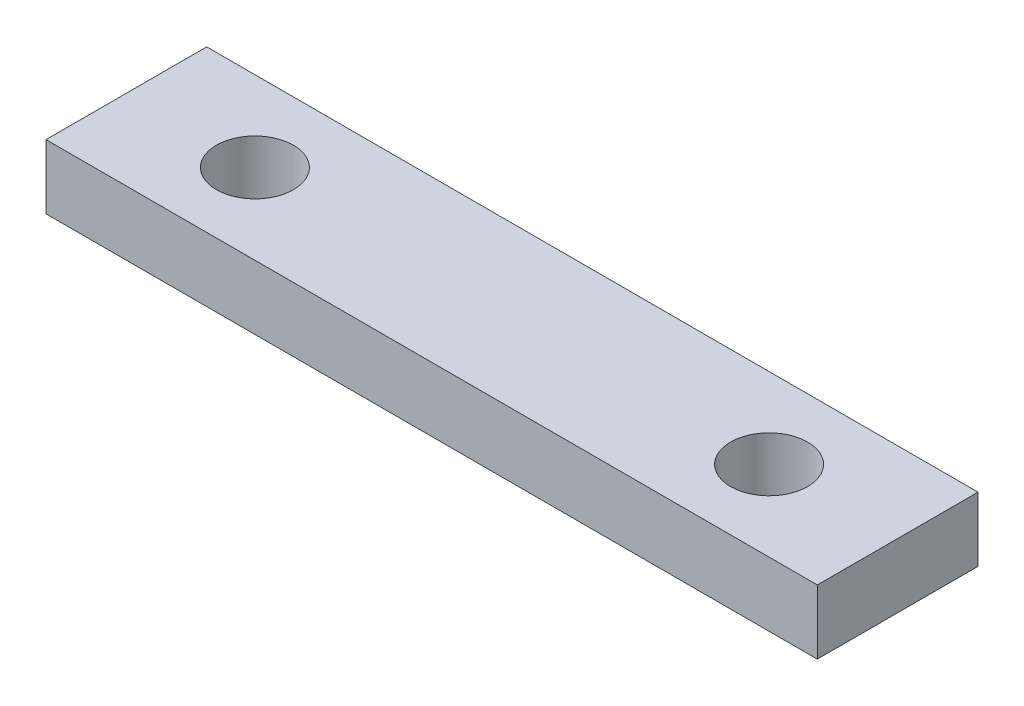
from build123d import *

# Parameters (mm, degrees)
SKETCH1_W           = 120
SKETCH1_H           = 25
SKETCH1_R           = 6
BOSS_EXTRUDE1_DEPTH = 10


with BuildPart() as part:
    # Sketch1 → Boss-Extrude1 (new body)
    with BuildSketch(Plane(origin=(0, 0, 0), x_dir=(1, 0, 0), z_dir=(0, 1, 0))):
        Rectangle(SKETCH1_W, SKETCH1_H)
        with Locations(Location((40, 0, 0), (0, 0, 270))):
            Circle(SKETCH1_R, mode=Mode.SUBTRACT)
        with Locations(Location((-40, 0, 0), (0, 0, 270))):
            Circle(SKETCH1_R, mode=Mode.SUBTRACT)
    extrude(amount=BOSS_EXTRUDE1_DEPTH)


solid = part.part
